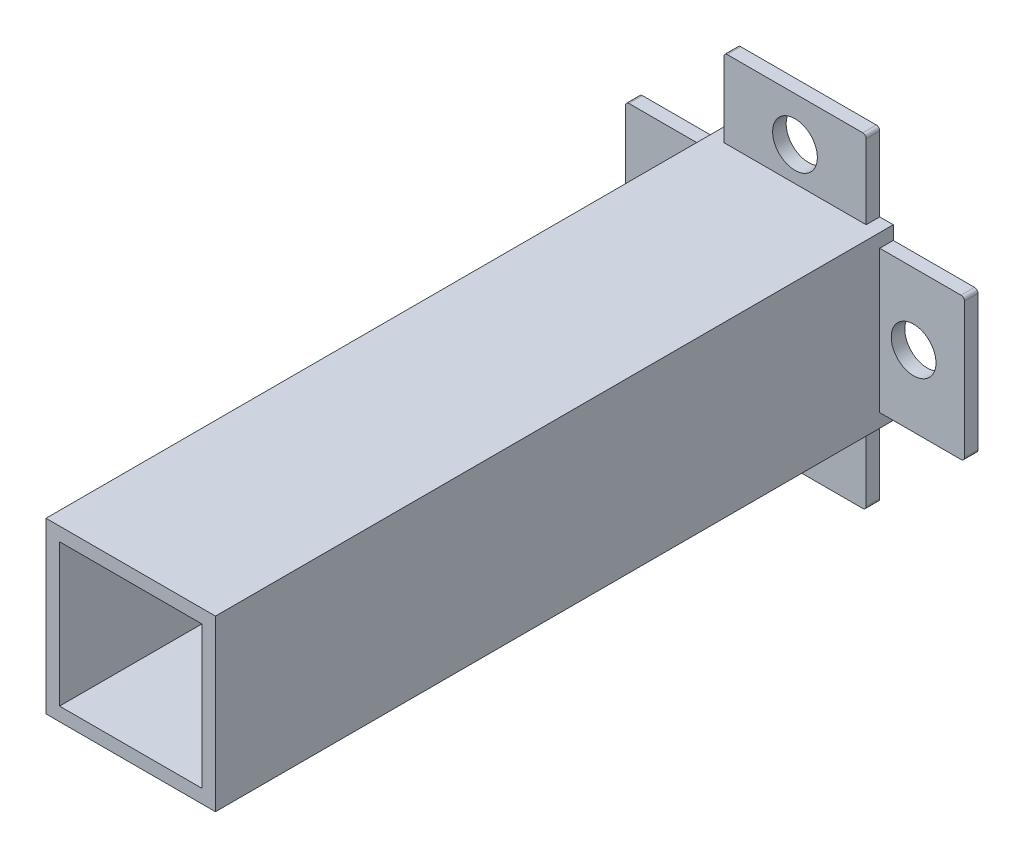
from build123d import *

# Parameters (mm, degrees)
SKETCH_1_W                  = 50
SKETCH_1_H                  = 48
EXTRUDE_1_DEPTH             = 15
HOLE_WIZARD_M5_1_AT_2_COUNT = 2
HOLE_WIZARD_M5_1_AT_2_PITCH = 35
HOLE_WIZARD_M5_1_AT_3_COUNT = 2
HOLE_WIZARD_M5_1_AT_3_PITCH = 49.497474683
HOLE_WIZARD_M5_1_AT_4_COUNT = 2
HOLE_WIZARD_M5_1_AT_4_PITCH = 35
FILLET_1_R                  = 1
SKETCH_11_W                 = 25
SKETCH_11_H                 = 25
SKETCH_11_W_2               = 21
SKETCH_11_H_2               = 21
EXTRUDE_2_DEPTH             = 100
SKETCH_11_3_W               = 21
SKETCH_11_3_H               = 11.5
SKETCH_11_3_R               = 3.3
SKETCH_11_3_W_2             = 12.5
SKETCH_11_3_H_2             = 21
EXTRUDE_3_DEPTH             = 2
SKETCH_12_W                 = 50
SKETCH_12_H                 = 15
CUT_EXTRUDE_1_DEPTH         = 135.272111773
FILLET_3_R                  = 0.5


with BuildPart() as part:
    # 草图1 → 凸台-拉伸1 (new body)
    with BuildSketch(Plane.XY):
        with Locations((25, -24)):
            Rectangle(SKETCH_1_W, SKETCH_1_H)
    extrude(amount=EXTRUDE_1_DEPTH)

    # 草图4 → M5 六角圆柱头螺钉的柱形沉头孔1 (revolve, cut)
    with BuildSketch(Plane(origin=(7.5, -6.5, 15), x_dir=(0, -1, 0), z_dir=(1, 0, 0))):
        Polygon((0, 0), (0, 15), (2.75, 15), (2.75, 6), (5, 6), (5, 0.025), (5.025, 0), align=None)
    hole_wizard_m5_1 = revolve(axis=Axis((7.5, -6.5, 21.35), (0, 0, -1)), mode=Mode.SUBTRACT)

    # M5 六角圆柱头螺钉的柱形沉头孔1 at 2: M5 六角圆柱头螺钉的柱形沉头孔1 ×2
    with Locations(*[(i * HOLE_WIZARD_M5_1_AT_2_PITCH, 0, 0) for i in range(1, HOLE_WIZARD_M5_1_AT_2_COUNT)]):
        add(hole_wizard_m5_1, mode=Mode.SUBTRACT)

    # M5 六角圆柱头螺钉的柱形沉头孔1 at 3: M5 六角圆柱头螺钉的柱形沉头孔1 ×2
    with Locations(*[Vector(0.7071067811865476, -0.7071067811865476, 0) * (i * HOLE_WIZARD_M5_1_AT_3_PITCH) for i in range(1, HOLE_WIZARD_M5_1_AT_3_COUNT)]):
        add(hole_wizard_m5_1, mode=Mode.SUBTRACT)

    # M5 六角圆柱头螺钉的柱形沉头孔1 at 4: M5 六角圆柱头螺钉的柱形沉头孔1 ×2
    with Locations(*[(0, -i * HOLE_WIZARD_M5_1_AT_4_PITCH, 0) for i in range(1, HOLE_WIZARD_M5_1_AT_4_COUNT)]):
        add(hole_wizard_m5_1, mode=Mode.SUBTRACT)

    # 圆角1
    fillet_1_edges = [part.edges().sort_by_distance(p)[0] for p in [
        (50, -48, 7.5),
        (0, -48, 7.5),
        (0, 0, 7.5),
        (50, 0, 7.5),
    ]]
    fillet(fillet_1_edges, radius=FILLET_1_R)

    # 草图10 → M8 六角圆柱头螺钉的柱形沉头孔1 (revolve, cut)
    with BuildSketch(Plane(origin=(25, -24, 0), x_dir=(0, 1, 0), z_dir=(1, 0, 0))):
        Polygon((0, 0), (0, 15), (4.5, 15), (4.5, 10), (7.5, 10), (7.5, 0.025), (7.525, 0), align=None)
    revolve(axis=Axis((25, -24, -6.35), (0, 0, 1)), mode=Mode.SUBTRACT)

    # 草图11 → 凸台-拉伸2 (add)
    with BuildSketch(Plane.XY.offset(15)):
        with Locations((25, -24)):
            Rectangle(SKETCH_11_W, SKETCH_11_H)
        with Locations((25, -24)):
            Rectangle(SKETCH_11_W_2, SKETCH_11_H_2, mode=Mode.SUBTRACT)
    extrude(amount=EXTRUDE_2_DEPTH)

    # 草图11<3> → 凸台-拉伸3 (add)
    # profile 1 of 4: a face of its own
    with BuildSketch(Plane.XY.offset(15)):
        with Locations((25, -5.75)):
            Rectangle(SKETCH_11_3_W, SKETCH_11_3_H)
        with Locations((25, -6.5)):
            Circle(SKETCH_11_3_R, mode=Mode.SUBTRACT)
    # profile 2 of 4: a face of its own
    with BuildSketch(Plane.XY.offset(15)):
        with Locations((6.25, -24)):
            Rectangle(SKETCH_11_3_W_2, SKETCH_11_3_H_2)
        with Locations((7.5, -24)):
            Circle(SKETCH_11_3_R, mode=Mode.SUBTRACT)
    # profile 3 of 4: a face of its own
    with BuildSketch(Plane.XY.offset(15)):
        with Locations((25, -42.25)):
            Rectangle(SKETCH_11_3_W, SKETCH_11_3_H)
        with Locations((25, -41.5)):
            Circle(SKETCH_11_3_R, mode=Mode.SUBTRACT)
    # profile 4 of 4: a face of its own
    with BuildSketch(Plane.XY.offset(15)):
        with Locations((43.75, -24)):
            Rectangle(SKETCH_11_3_W_2, SKETCH_11_3_H_2)
        with Locations((42.5, -24)):
            Circle(SKETCH_11_3_R, mode=Mode.SUBTRACT)
    extrude(amount=EXTRUDE_3_DEPTH)

    # 草图12 → 切除-拉伸1 (cut, through all)
    with BuildSketch(Plane.XZ.offset(48)):
        with Locations((25, 7.5)):
            Rectangle(SKETCH_12_W, SKETCH_12_H)
    extrude(amount=-CUT_EXTRUDE_1_DEPTH, mode=Mode.SUBTRACT)

    # 圆角3
    fillet_3_edges = [part.edges().sort_by_distance(p)[0] for p in [
        (14.5, 0, 16),
        (0, -13.5, 16),
        (35.5, 0, 16),
        (50, -34.5, 16),
        (50, -13.5, 16),
        (35.5, -48, 16),
        (0, -34.5, 16),
        (14.5, -48, 16),
    ]]
    fillet(fillet_3_edges, radius=FILLET_3_R)


solid = part.part
